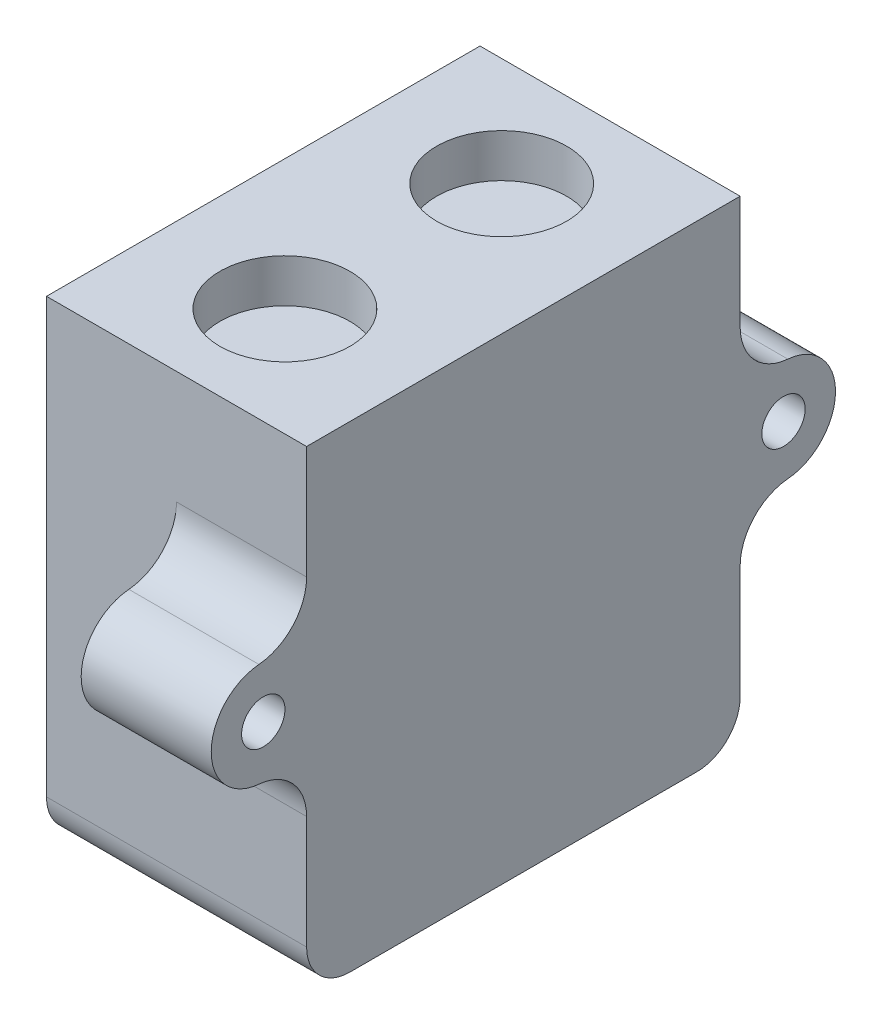
from build123d import *

# Parameters (mm, degrees)
SKETCH2_W           = 100
SKETCH2_H           = 100
BOSS_EXTRUDE1_DEPTH = 60
SKETCH3_R           = 31
CUT_EXTRUDE1_DEPTH  = 30
FILLET1_R           = 10
SKETCH4_W           = 60
SKETCH4_H           = 100
SKETCH4_R           = 15
BOSS_EXTRUDE2_DEPTH = 10
SKETCH6_R           = 5
BOSS_EXTRUDE3_DEPTH = 30


with BuildPart() as part:
    # Sketch2 → Boss-Extrude1 (new body)
    with BuildSketch(Plane(origin=(0, 0, 0), x_dir=(0, 0, -1), z_dir=(1, 0, 0))):
        Rectangle(SKETCH2_W, SKETCH2_H)
    extrude(amount=BOSS_EXTRUDE1_DEPTH)

    # Sketch3 → Cut-Extrude1 (cut)
    with BuildSketch(Plane.ZY):
        Circle(SKETCH3_R)
    extrude(amount=-CUT_EXTRUDE1_DEPTH, mode=Mode.SUBTRACT)

    # Fillet1
    fillet1_edges = [part.edges().sort_by_distance(p)[0] for p in [
        (30, -50, -50),
        (30, -50, 50),
    ]]
    fillet(fillet1_edges, radius=FILLET1_R)

    # Sketch4 → Boss-Extrude2 (add)
    with BuildSketch(Plane(origin=(0, 50, 0), x_dir=(1, 0, 0), z_dir=(0, 1, 0))):
        with Locations((30, 0)):
            Rectangle(SKETCH4_W, SKETCH4_H)
        with Locations(Location((30, 25, 0), (0, 0, 270))):
            Circle(SKETCH4_R, mode=Mode.SUBTRACT)
        with Locations(Location((30, -25, 0), (0, 0, 270))):
            Circle(SKETCH4_R, mode=Mode.SUBTRACT)
    extrude(amount=BOSS_EXTRUDE2_DEPTH)

    # Sketch6 → Boss-Extrude3 (add)
    with BuildSketch(Plane(origin=(60, 0, 0), x_dir=(0, 0, -1), z_dir=(1, 0, 0))):
        with BuildLine():
            Line((-50, 33.916521486), (-50, -13.916521486))
            ThreePointArc((-50, -13.916521486), (-53.168239134, -5.792483082), (-61, -1.958260743))
            ThreePointArc((-61, -1.958260743), (-72, 10), (-61, 21.958260743))
            ThreePointArc((-61, 21.958260743), (-53.168239134, 25.792483082), (-50, 33.916521486))
        make_face()
        with Locations((-60, 10)):
            Circle(SKETCH6_R, mode=Mode.SUBTRACT)
    boss_extrude3 = extrude(amount=-BOSS_EXTRUDE3_DEPTH)

    # Mirror1: Boss-Extrude3 across plane
    add(boss_extrude3.mirror(Plane(origin=(0, 0, 0), x_dir=(1, 0, 0), z_dir=(0, 0, -1))))


solid = part.part
